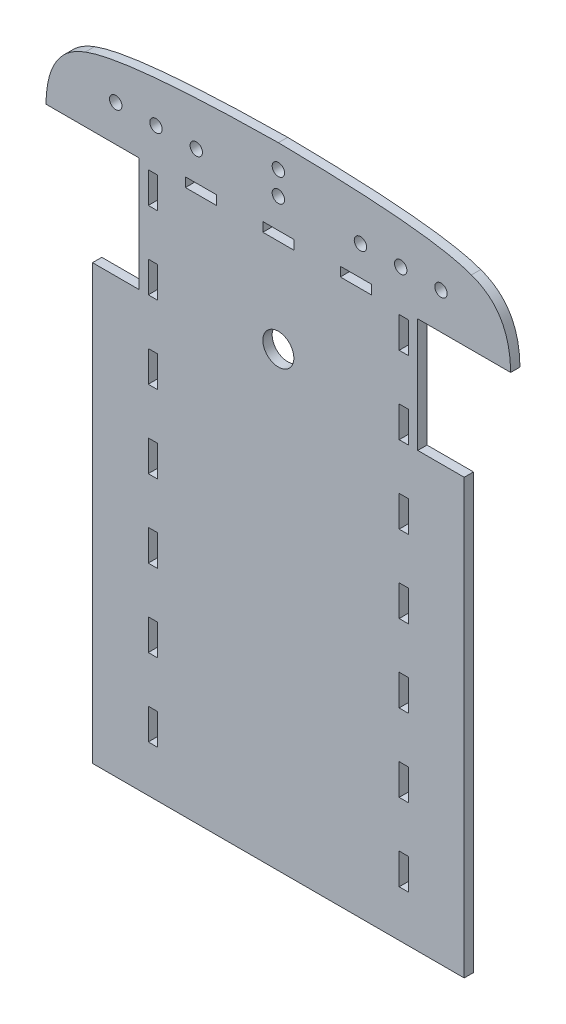
from build123d import *

# Parameters (mm, degrees)
ESQUISSE1_R             = 5
ESQUISSE1_R_2           = 2
BOSS_EXTRU_1_DEPTH      = 3
ESQUISSE3_W             = 3
ESQUISSE3_H             = 10
ESQUISSE3_W_2           = 10
ESQUISSE3_H_2           = 3
ENL_V_MAT_EXTRU_1_DEPTH = 165.022412006


with BuildPart() as part:
    # Esquisse1 → Boss.-Extru.1 (new body)
    with BuildSketch(Plane.XY):
        with BuildLine():
            Line((78.109352882, -135), (-41.890647118, -135))
            Line((-41.890647118, -135), (-41.890647118, 5))
            Line((-41.890647118, 5), (-26.890647118, 5))
            Line((-26.890647118, 5), (-26.890647118, 41.795417818))
            Line((-26.890647118, 41.795417818), (-56.890647118, 41.795417818))
            add(Edge.make_bspline(
                [(-56.890647118, 41.795417818), (-56.746915478, 58.294848354), (-44.215904994, 62.728898217)],
                knots=[0, 0, 0, 1, 1, 1], degree=2))
            add(Edge.make_bspline(
                [(-44.215904994, 62.728898217), (-30.528185851, 67.934087187), (18.109352882, 68.550704045)],
                knots=[0, 0, 0, 1, 1, 1], degree=2))
            add(Edge.make_bspline(
                [(80.434610758, 62.728898217), (66.746891614, 67.934087187), (18.109352882, 68.550704045)],
                knots=[0, 0, 0, 1, 1, 1], degree=2))
            add(Edge.make_bspline(
                [(93.109352882, 41.795417818), (92.965621241, 58.294848354), (80.434610758, 62.728898217)],
                knots=[0, 0, 0, 1, 1, 1], degree=2))
            Line((93.109352882, 41.795417818), (63.109352882, 41.795417818))
            Line((63.109352882, 41.795417818), (63.109352882, 5))
            Line((63.109352882, 5), (78.109352882, 5))
            Line((78.109352882, 5), (78.109352882, -135))
        make_face()
        with Locations((18.109352882, 10.811644987)):
            Circle(ESQUISSE1_R, mode=Mode.SUBTRACT)
        with Locations((18.109352882, 53.550704045)):
            Circle(ESQUISSE1_R_2, mode=Mode.SUBTRACT)
        with Locations((-8.390647118, 53.550704045)):
            Circle(ESQUISSE1_R_2, mode=Mode.SUBTRACT)
        with Locations((-34.390647118, 53.550704045)):
            Circle(ESQUISSE1_R_2, mode=Mode.SUBTRACT)
        with Locations(Location((70.609352882, 53.550704045, 0), (0, 0, 180))):
            Circle(ESQUISSE1_R_2, mode=Mode.SUBTRACT)
        with Locations(Location((44.609352882, 53.550704045, 0), (0, 0, 180))):
            Circle(ESQUISSE1_R_2, mode=Mode.SUBTRACT)
        with Locations((18.109352882, 61.055482272)):
            Circle(ESQUISSE1_R_2, mode=Mode.SUBTRACT)
        with Locations((-21.390647118, 53.550704045)):
            Circle(ESQUISSE1_R_2, mode=Mode.SUBTRACT)
        with Locations(Location((57.609352882, 53.550704045, 0), (0, 0, 180))):
            Circle(ESQUISSE1_R_2, mode=Mode.SUBTRACT)
    extrude(amount=BOSS_EXTRU_1_DEPTH)

    # Esquisse3 → Enlèv. mat.-Extru.1 (cut, through all)
    with BuildSketch(Plane.XY.offset(3)):
        with Locations((-22.390647118, -115)):
            Rectangle(ESQUISSE3_W, ESQUISSE3_H)
        with Locations((-22.390647118, -90)):
            Rectangle(ESQUISSE3_W, ESQUISSE3_H)
        with Locations((-22.390647118, -65)):
            Rectangle(ESQUISSE3_W, ESQUISSE3_H)
        with Locations((-22.390647118, -40)):
            Rectangle(ESQUISSE3_W, ESQUISSE3_H)
        with Locations((-22.390647118, -15)):
            Rectangle(ESQUISSE3_W, ESQUISSE3_H)
        with Locations((-22.390647118, 10)):
            Rectangle(ESQUISSE3_W, ESQUISSE3_H)
        with Locations((-22.390647118, 35)):
            Rectangle(ESQUISSE3_W, ESQUISSE3_H)
        with Locations((58.609352882, -15)):
            Rectangle(ESQUISSE3_W, ESQUISSE3_H)
        with Locations((58.609352882, 10)):
            Rectangle(ESQUISSE3_W, ESQUISSE3_H)
        with Locations((58.609352882, 35)):
            Rectangle(ESQUISSE3_W, ESQUISSE3_H)
        with Locations((58.609352882, -65)):
            Rectangle(ESQUISSE3_W, ESQUISSE3_H)
        with Locations((58.609352882, -40)):
            Rectangle(ESQUISSE3_W, ESQUISSE3_H)
        with Locations((58.609352882, -90)):
            Rectangle(ESQUISSE3_W, ESQUISSE3_H)
        with Locations((58.609352882, -115)):
            Rectangle(ESQUISSE3_W, ESQUISSE3_H)
        with Locations((-6.890647118, 42.5)):
            Rectangle(ESQUISSE3_W_2, ESQUISSE3_H_2)
        with Locations((18.109352882, 42.5)):
            Rectangle(ESQUISSE3_W_2, ESQUISSE3_H_2)
        with Locations((43.109352882, 42.5)):
            Rectangle(ESQUISSE3_W_2, ESQUISSE3_H_2)
    extrude(amount=-ENL_V_MAT_EXTRU_1_DEPTH, mode=Mode.SUBTRACT)


solid = part.part
